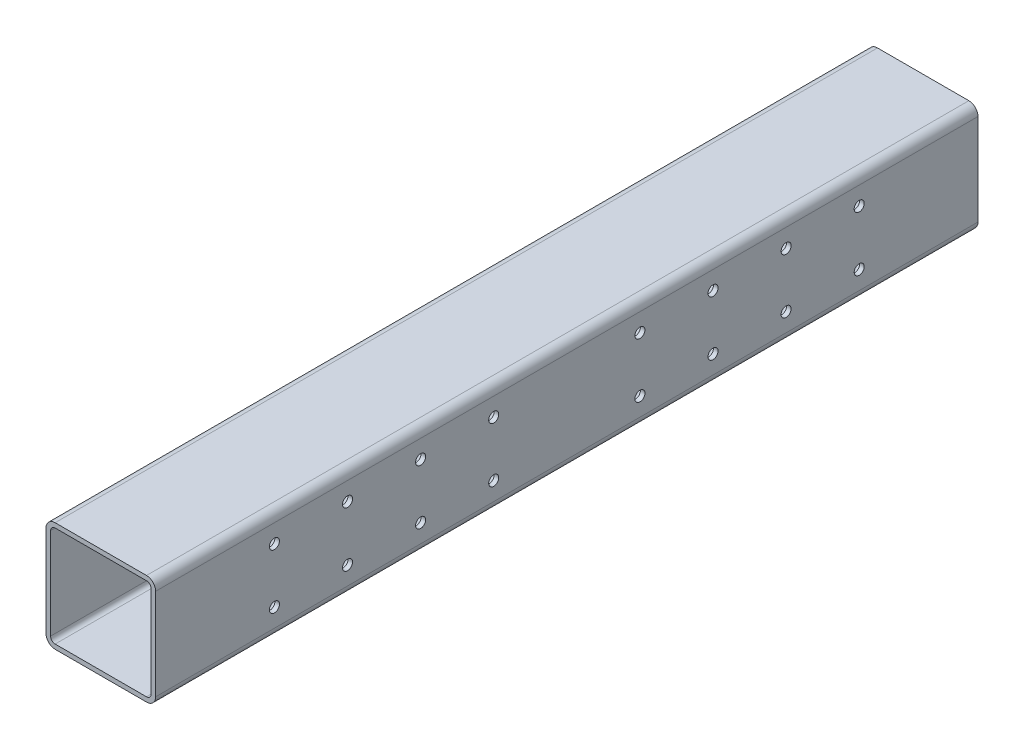
from build123d import *

# Parameters (mm, degrees)
BOSS_EXTRUDE1_DEPTH = 571.5
SKETCH2_R           = 6.985
CUT_EXTRUDE1_DEPTH  = 597.359329599


with BuildPart() as part:
    # Sketch1 → Boss-Extrude1 (new, symmetric)
    with BuildSketch(Plane.XY):
        with BuildLine():
            Line((-63.5, -76.2), (63.5, -76.2))
            ThreePointArc((63.5, -76.2), (72.480256121, -72.480256121), (76.2, -63.5))
            Line((76.2, -63.5), (76.2, 63.5))
            ThreePointArc((76.2, 63.5), (72.480256121, 72.480256121), (63.5, 76.2))
            Line((63.5, 76.2), (-63.5, 76.2))
            ThreePointArc((-63.5, 76.2), (-72.480256121, 72.480256121), (-76.2, 63.5))
            Line((-76.2, 63.5), (-76.2, -63.5))
            ThreePointArc((-76.2, -63.5), (-72.480256121, -72.480256121), (-63.5, -76.2))
        make_face()
        with BuildLine():
            Line((-63.5, 69.85), (63.5, 69.85))
            ThreePointArc((63.5, 69.85), (67.990128061, 67.990128061), (69.85, 63.5))
            Line((69.85, 63.5), (69.85, -63.5))
            ThreePointArc((69.85, -63.5), (67.990128061, -67.990128061), (63.5, -69.85))
            Line((63.5, -69.85), (-63.5, -69.85))
            ThreePointArc((-63.5, -69.85), (-67.990128061, -67.990128061), (-69.85, -63.5))
            Line((-69.85, -63.5), (-69.85, 63.5))
            ThreePointArc((-69.85, 63.5), (-67.990128061, 67.990128061), (-63.5, 69.85))
        make_face(mode=Mode.SUBTRACT)
    extrude(amount=BOSS_EXTRUDE1_DEPTH, both=True)

    # Sketch2 → Cut-Extrude1 (cut, through all)
    with BuildSketch(Plane.ZY.offset(76.2)):
        with Locations((-101.6, 38.1)):
            Circle(SKETCH2_R)
        with Locations((-203.2, 38.1)):
            Circle(SKETCH2_R)
        with Locations((-304.8, 38.1)):
            Circle(SKETCH2_R)
        with Locations((-304.8, -38.1)):
            Circle(SKETCH2_R)
        with Locations((-203.2, -38.1)):
            Circle(SKETCH2_R)
        with Locations((-101.6, -38.1)):
            Circle(SKETCH2_R)
        with Locations((101.6, -38.1)):
            Circle(SKETCH2_R)
        with Locations((203.2, -38.1)):
            Circle(SKETCH2_R)
        with Locations((304.8, -38.1)):
            Circle(SKETCH2_R)
        with Locations((304.8, 38.1)):
            Circle(SKETCH2_R)
        with Locations((203.2, 38.1)):
            Circle(SKETCH2_R)
        with Locations((101.6, 38.1)):
            Circle(SKETCH2_R)
        with Locations((-406.4, 38.1)):
            Circle(SKETCH2_R)
        with Locations((-406.4, -38.1)):
            Circle(SKETCH2_R)
        with Locations((406.4, -38.1)):
            Circle(SKETCH2_R)
        with Locations((406.4, 38.1)):
            Circle(SKETCH2_R)
    extrude(amount=-CUT_EXTRUDE1_DEPTH, mode=Mode.SUBTRACT)


solid = part.part
